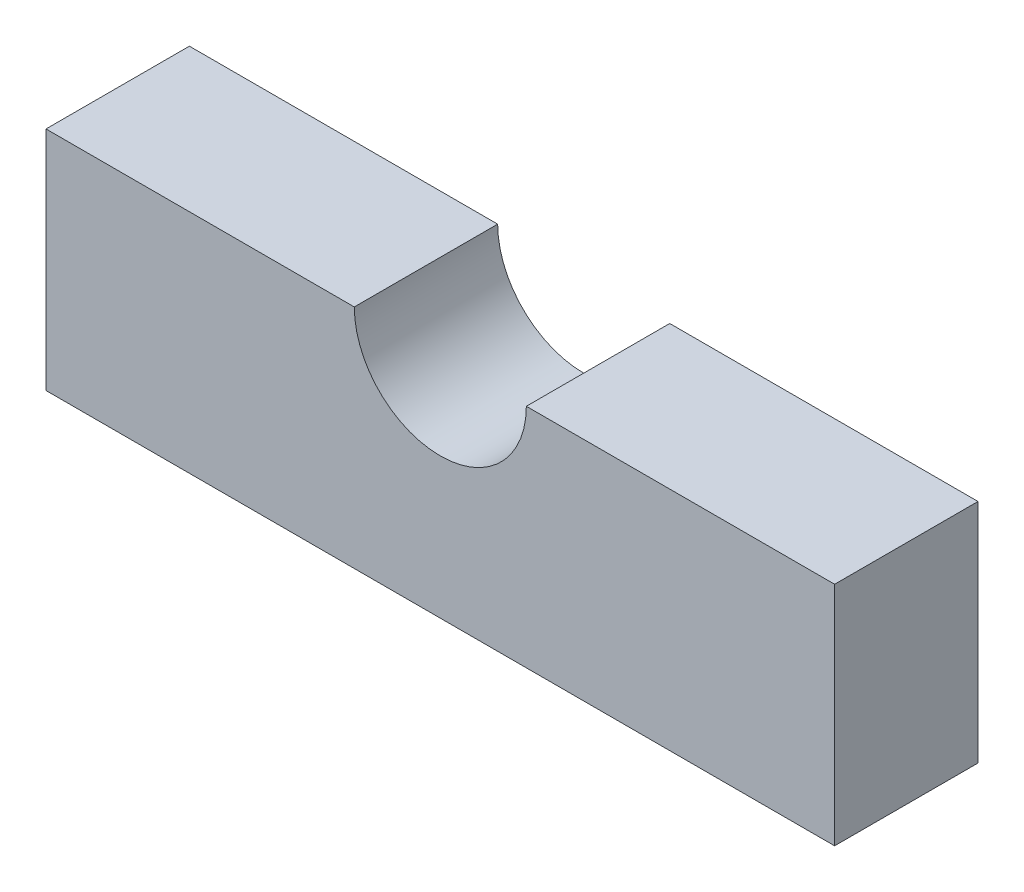
from build123d import *

# Parameters (mm, degrees)
SKETCH1_W           = 69.85
SKETCH1_H           = 12.7
BOSS_EXTRUDE1_DEPTH = 20.066
SKETCH3_R           = 7.62
CUT_EXTRUDE3_DEPTH  = 25.4
SKETCH4_R           = 1.27
CUT_EXTRUDE4_DEPTH  = 5.08


with BuildPart() as part:
    # Sketch1 → Boss-Extrude1 (new body)
    with BuildSketch(Plane(origin=(0, 0, 0), x_dir=(1, 0, 0), z_dir=(0, 1, 0))):
        Rectangle(SKETCH1_W, SKETCH1_H)
    extrude(amount=BOSS_EXTRUDE1_DEPTH)

    # Sketch3 → Cut-Extrude3 (cut)
    with BuildSketch(Plane(origin=(0, 0, -6.35), x_dir=(-1, 0, 0), z_dir=(0, 0, -1))):
        with Locations((0, 20.066)):
            Circle(SKETCH3_R)
    extrude(amount=-CUT_EXTRUDE3_DEPTH, mode=Mode.SUBTRACT)

    # Sketch4 → Cut-Extrude4 (cut)
    with BuildSketch(Plane(origin=(0, 0, 0), x_dir=(-1, 0, 0), z_dir=(0, -1, 0))):
        with Locations(Location((25.4, 0, 0), (0, 0, 90))):
            Circle(SKETCH4_R)
        with Locations(Location((-25.4, 0, 0), (0, 0, 90))):
            Circle(SKETCH4_R)
    extrude(amount=-CUT_EXTRUDE4_DEPTH, mode=Mode.SUBTRACT)


solid = part.part
